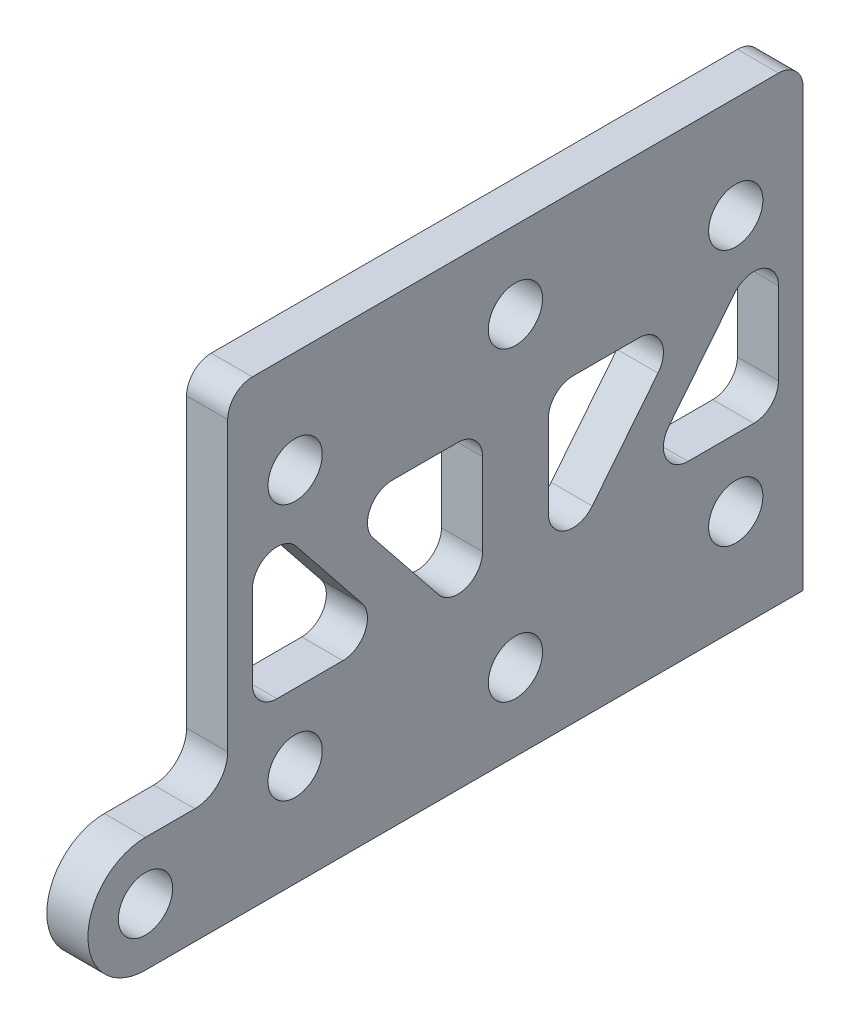
from build123d import *

# Parameters (mm, degrees)
IZIM1_R                     = 1.65
Y_KSEKLIK_EKSTR_ZYON1_DEPTH = 2.5
RADYUS1_RADIUS              = 3.5
RADYUS1_LENGTH              = 2.5
RADYUS3_R                   = 2
RADYUS4_R                   = 1.5
KES_EKSTR_ZYON1_DEPTH       = 52.79285665


with BuildPart() as part:
    # Çizim1 → Yükseklik-Ekstrüzyon1 (new body)
    with BuildSketch(Plane(origin=(0, 0, 0), x_dir=(0, 0, -1), z_dir=(1, 0, 0))):
        with BuildLine():
            Line((0, 0), (0, 26.5))
            ThreePointArc((0, 26.5), (-0.439339828, 27.560660172), (-1.5, 28))
            Line((-1.5, 28), (-35, 28))
            Line((-35, 28), (-35, 7))
            Line((-35, 7), (-43.5, 7))
            Line((-43.5, 7), (-43.5, 0))
            Line((-43.5, 0), (0, 0))
        make_face()
        with Locations((-17.5, 23.3)):
            Circle(IZIM1_R, mode=Mode.SUBTRACT)
        with Locations((-17.5, 4.7)):
            Circle(IZIM1_R, mode=Mode.SUBTRACT)
        with Locations((-30.9, 6.2)):
            Circle(IZIM1_R, mode=Mode.SUBTRACT)
        with Locations((-30.9, 21.8)):
            Circle(IZIM1_R, mode=Mode.SUBTRACT)
        with Locations((-4.1, 6.2)):
            Circle(IZIM1_R, mode=Mode.SUBTRACT)
        with Locations((-4.1, 21.8)):
            Circle(IZIM1_R, mode=Mode.SUBTRACT)
        with Locations((-40, 3.5)):
            Circle(IZIM1_R, mode=Mode.SUBTRACT)
    extrude(amount=Y_KSEKLIK_EKSTR_ZYON1_DEPTH)

    # Radyus1: full round fillet: the end face becomes a half cylinder, R = half its width
    radyus1_face = Plane((1.25, 3.5, 43.5), x_dir=(1, 0, 0), z_dir=(0, 0, 1))  # on the end face: x along it, z out of the body
    radyus1_slab = radyus1_face.offset(-RADYUS1_RADIUS / 2) * Box(RADYUS1_LENGTH, 2 * RADYUS1_RADIUS, RADYUS1_RADIUS, mode=Mode.PRIVATE)  # the body's end, R deep
    radyus1_round = Plane((1.25, 3.5, 40), x_dir=(0, 0, 1), z_dir=(1, 0, 0)) * Cylinder(RADYUS1_RADIUS, RADYUS1_LENGTH, mode=Mode.PRIVATE)  # its axis R under the face
    add(radyus1_slab - radyus1_round, mode=Mode.SUBTRACT)

    # Radyus3
    radyus3_edges = [part.edges().sort_by_distance(p)[0] for p in [
        (1.25, 7, 35),
    ]]
    fillet(radyus3_edges, radius=RADYUS3_R)

    # Radyus4
    radyus4_edges = [part.edges().sort_by_distance(p)[0] for p in [
        (1.25, 28, 35),
    ]]
    fillet(radyus4_edges, radius=RADYUS4_R)

    # Çizim2 → Kes-Ekstrüzyon1 (cut, through all)
    with BuildSketch(Plane(origin=(2.5, 0, 0), x_dir=(0, 0, -1), z_dir=(1, 0, 0))):
        with BuildLine():
            Line((-33.5, 16.8), (-33.5, 11.8))
            ThreePointArc((-33.5, 11.8), (-33.060660172, 10.739339828), (-32, 10.3))
            Line((-32, 10.3), (-28, 10.3))
            ThreePointArc((-28, 10.3), (-26.648045146, 11.150216904), (-26.828696786, 12.737042571))
            Line((-26.828696786, 12.737042571), (-30.828696786, 17.737042571))
            ThreePointArc((-30.828696786, 17.737042571), (-32.496510412, 18.215442479), (-33.5, 16.8))
        make_face()
        with BuildLine():
            Line((-25, 18.3), (-21, 18.3))
            ThreePointArc((-21, 18.3), (-19.939339828, 17.860660172), (-19.5, 16.8))
            Line((-19.5, 16.8), (-19.5, 11.8))
            ThreePointArc((-19.5, 11.8), (-20.503489588, 10.384557521), (-22.171303214, 10.862957429))
            Line((-22.171303214, 10.862957429), (-26.171303214, 15.862957429))
            ThreePointArc((-26.171303214, 15.862957429), (-26.351954854, 17.449783096), (-25, 18.3))
        make_face()
        with BuildLine():
            Line((-12.828696786, 10.862957429), (-8.828696786, 15.862957429))
            ThreePointArc((-8.828696786, 15.862957429), (-8.648045146, 17.449783096), (-10, 18.3))
            Line((-10, 18.3), (-14, 18.3))
            ThreePointArc((-14, 18.3), (-15.060660172, 17.860660172), (-15.5, 16.8))
            Line((-15.5, 16.8), (-15.5, 11.8))
            ThreePointArc((-15.5, 11.8), (-14.496510412, 10.384557521), (-12.828696786, 10.862957429))
        make_face()
        with BuildLine():
            Line((-8.171303214, 12.737042571), (-4.171303214, 17.737042571))
            ThreePointArc((-4.171303214, 17.737042571), (-2.503489588, 18.215442479), (-1.5, 16.8))
            Line((-1.5, 16.8), (-1.5, 11.8))
            ThreePointArc((-1.5, 11.8), (-1.939339828, 10.739339828), (-3, 10.3))
            Line((-3, 10.3), (-7, 10.3))
            ThreePointArc((-7, 10.3), (-8.351954854, 11.150216904), (-8.171303214, 12.737042571))
        make_face()
    extrude(amount=-KES_EKSTR_ZYON1_DEPTH, mode=Mode.SUBTRACT)


solid = part.part
